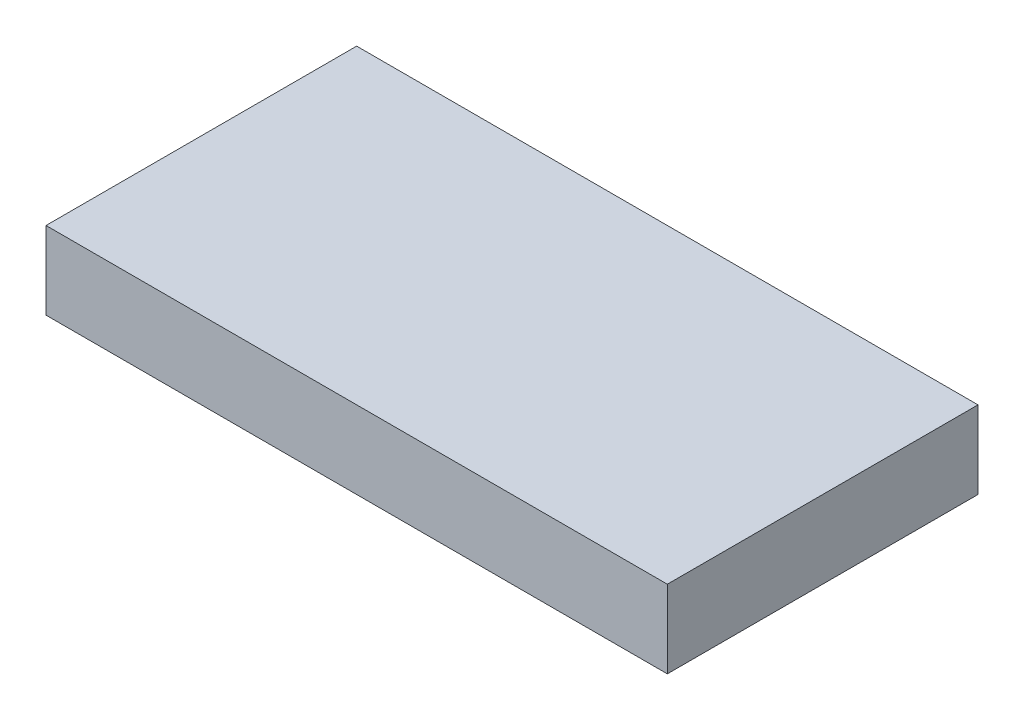
from build123d import *

# Parameters (mm, degrees)
SKETCH1_W           = 50.8
SKETCH1_H           = 25.4
BOSS_EXTRUDE1_DEPTH = 6.35


with BuildPart() as part:
    # Sketch1 → Boss-Extrude1 (new body)
    with BuildSketch(Plane(origin=(0, 0, 0), x_dir=(1, 0, 0), z_dir=(0, 1, 0))):
        with Locations((-14.374725275, 0.209340659)):
            Rectangle(SKETCH1_W, SKETCH1_H)
    extrude(amount=BOSS_EXTRUDE1_DEPTH)


solid = part.part
